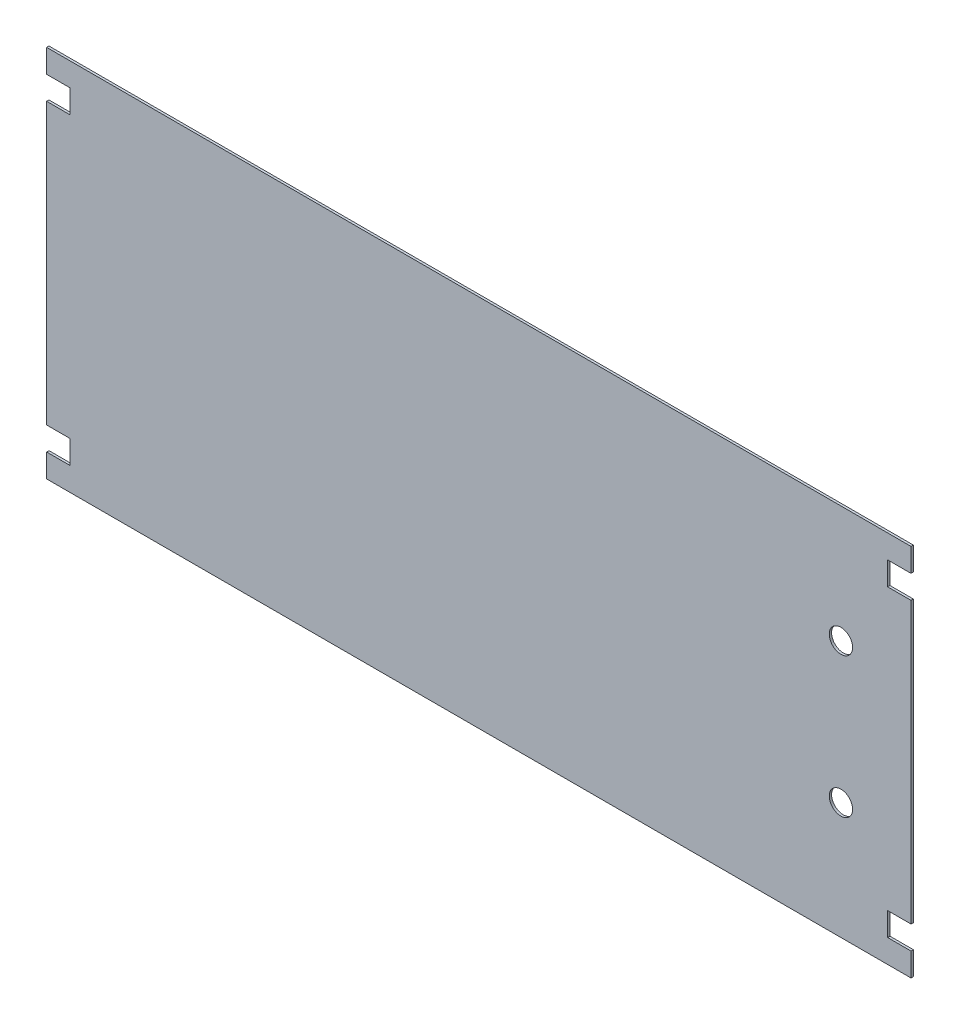
from build123d import *

# Parameters (mm, degrees)
SKETCH1_W                  = 370
SKETCH1_H                  = 160
KICH_THUOC_TONG_QUAN_DEPTH = 1
LO_CHOT_CO_DINH_REACH      = 405.114
SKETCH2_W                  = 10
SKETCH2_H                  = 10
LO_THONG_KHI_REACH         = 405.114
SKETCH3_R                  = 5


with BuildPart() as part:
    # Sketch1 → kich_thuoc_tong_quan (new body)
    with BuildSketch(Plane.XY):
        with Locations((185, 80)):
            Rectangle(SKETCH1_W, SKETCH1_H)
    extrude(amount=KICH_THUOC_TONG_QUAN_DEPTH)

    # Sketch2 → lo_chot_co_dinh (cut, up to next)
    with BuildSketch(Plane.XY.offset(1), mode=Mode.PRIVATE) as lo_chot_co_dinh_sk1:
        with Locations((5, 145)):
            Rectangle(SKETCH2_W, SKETCH2_H)
    lo_chot_co_dinh_tool1 = extrude(lo_chot_co_dinh_sk1.sketch, amount=-LO_CHOT_CO_DINH_REACH, mode=Mode.PRIVATE) & part.part
    # Sketch2 → lo_chot_co_dinh (cut, up to next)
    with BuildSketch(Plane.XY.offset(1), mode=Mode.PRIVATE) as lo_chot_co_dinh_sk2:
        with Locations((365, 145)):
            Rectangle(SKETCH2_W, SKETCH2_H)
    lo_chot_co_dinh_tool2 = extrude(lo_chot_co_dinh_sk2.sketch, amount=-LO_CHOT_CO_DINH_REACH, mode=Mode.PRIVATE) & part.part
    # Sketch2 → lo_chot_co_dinh (cut, up to next)
    with BuildSketch(Plane.XY.offset(1), mode=Mode.PRIVATE) as lo_chot_co_dinh_sk3:
        with Locations((365, 15)):
            Rectangle(SKETCH2_W, SKETCH2_H)
    lo_chot_co_dinh_tool3 = extrude(lo_chot_co_dinh_sk3.sketch, amount=-LO_CHOT_CO_DINH_REACH, mode=Mode.PRIVATE) & part.part
    # Sketch2 → lo_chot_co_dinh (cut, up to next)
    with BuildSketch(Plane.XY.offset(1), mode=Mode.PRIVATE) as lo_chot_co_dinh_sk4:
        with Locations((5, 15)):
            Rectangle(SKETCH2_W, SKETCH2_H)
    lo_chot_co_dinh_tool4 = extrude(lo_chot_co_dinh_sk4.sketch, amount=-LO_CHOT_CO_DINH_REACH, mode=Mode.PRIVATE) & part.part
    add(lo_chot_co_dinh_tool1.solids().sort_by_distance((5, 145, 1))[0], mode=Mode.SUBTRACT)
    add(lo_chot_co_dinh_tool2.solids().sort_by_distance((365, 145, 1))[0], mode=Mode.SUBTRACT)
    add(lo_chot_co_dinh_tool3.solids().sort_by_distance((365, 15, 1))[0], mode=Mode.SUBTRACT)
    add(lo_chot_co_dinh_tool4.solids().sort_by_distance((5, 15, 1))[0], mode=Mode.SUBTRACT)

    # Sketch3 → lo_thong_khi (cut, up to next)
    with BuildSketch(Plane.XY.offset(1), mode=Mode.PRIVATE) as lo_thong_khi_sk1:
        with Locations((340, 110)):
            Circle(SKETCH3_R)
    lo_thong_khi_tool1 = extrude(lo_thong_khi_sk1.sketch, amount=-LO_THONG_KHI_REACH, mode=Mode.PRIVATE) & part.part
    # Sketch3 → lo_thong_khi (cut, up to next)
    with BuildSketch(Plane.XY.offset(1), mode=Mode.PRIVATE) as lo_thong_khi_sk2:
        with Locations((340, 50)):
            Circle(SKETCH3_R)
    lo_thong_khi_tool2 = extrude(lo_thong_khi_sk2.sketch, amount=-LO_THONG_KHI_REACH, mode=Mode.PRIVATE) & part.part
    add(lo_thong_khi_tool1.solids().sort_by_distance((340, 110, 1))[0], mode=Mode.SUBTRACT)
    add(lo_thong_khi_tool2.solids().sort_by_distance((340, 50, 1))[0], mode=Mode.SUBTRACT)


solid = part.part
